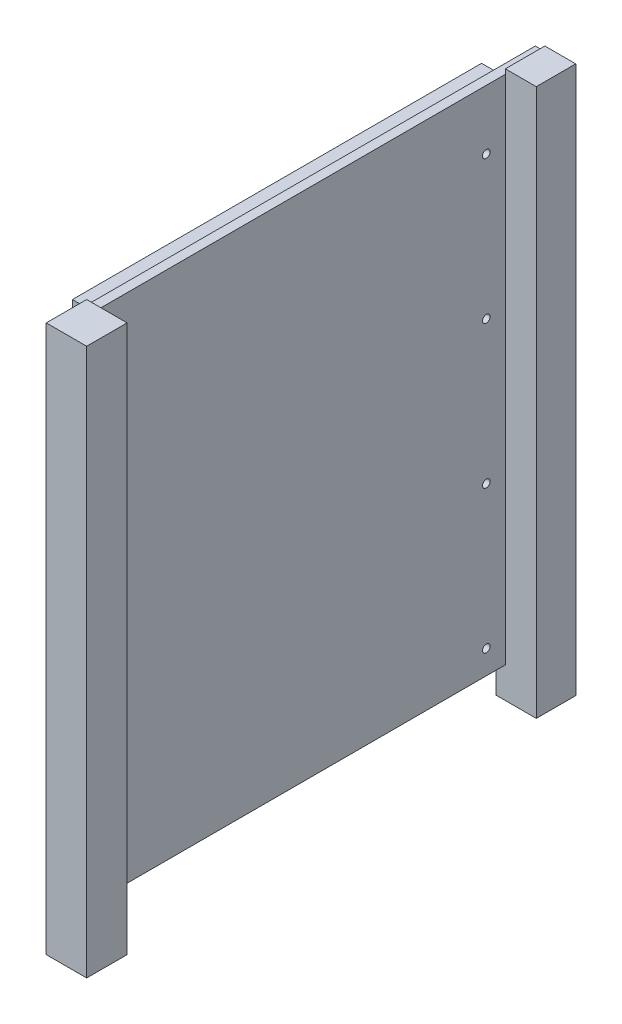
from build123d import *

# Parameters (mm, degrees)
SKETCH1_W             = 8.5
SKETCH1_H             = 115
BOSS_EXTRUDE1_DEPTH   = 8.5
BOSS_EXTRUDE2_DEPTH   = 2
SKETCH3_W             = 8.3
SKETCH3_H             = 115
BOSS_EXTRUDE3_DEPTH   = 6.5
SKETCH4_W             = 86
SKETCH4_H             = 107
BOSS_EXTRUDE4_DEPTH   = 3
SKETCH5_W             = 78
SKETCH5_H             = 99
CUT_EXTRUDE1_DEPTH    = 152.589420805
FILLET2_R             = 3
FILLET12_R            = 2
FILLET13_R            = 2
SKETCH64_W            = 78
SKETCH64_H            = 99
BOSS_EXTRUDE12_DEPTH  = 5
M2X0_4_TAPPED_HOLE1_D = 1.6


with BuildPart() as part:
    # Sketch1 → Boss-Extrude1 (new body)
    with BuildSketch(Plane(origin=(4.25, 0, 0), x_dir=(0, 0, -1), z_dir=(1, 0, 0))):
        with Locations((0, 57.5)):
            Rectangle(SKETCH1_W, SKETCH1_H)
    extrude(amount=-BOSS_EXTRUDE1_DEPTH)

    # Sketch2 → Boss-Extrude2 (add)
    with BuildSketch(Plane(origin=(-4.25, 0, 0), x_dir=(0, -1, 0), z_dir=(-1, 0, 0))):
        Polygon((-6.5, -90.25), (-6.5, -4.25), (-114, -4.25), (-114, -98.55), (0, -98.55), (0, -90.25), align=None)
    extrude(amount=-BOSS_EXTRUDE2_DEPTH)

    # Sketch3 → Boss-Extrude3 (add)
    with BuildSketch(Plane(origin=(-2.25, 0, 0), x_dir=(0, 0, -1), z_dir=(1, 0, 0))):
        with Locations((94.4, 57.5)):
            Rectangle(SKETCH3_W, SKETCH3_H)
    extrude(amount=BOSS_EXTRUDE3_DEPTH)

    # Sketch4 → Boss-Extrude4 (add)
    with BuildSketch(Plane.ZY.offset(4.25)):
        with Locations((-47.25, 60)):
            Rectangle(SKETCH4_W, SKETCH4_H)
    extrude(amount=BOSS_EXTRUDE4_DEPTH)

    # Sketch5 → Cut-Extrude1 (cut, through all)
    with BuildSketch(Plane(origin=(-2.25, 0, 0), x_dir=(0, 0, -1), z_dir=(1, 0, 0))):
        with Locations((47.25, 60)):
            Rectangle(SKETCH5_W, SKETCH5_H)
    extrude(amount=-CUT_EXTRUDE1_DEPTH, mode=Mode.SUBTRACT)

    # Fillet2
    fillet2_edges = [part.edges().sort_by_distance(p)[0] for p in [
        (-4.75, 10.5, -8.25),
        (-4.75, 109.5, -8.25),
        (-4.75, 109.5, -86.25),
        (-4.75, 10.5, -86.25),
    ]]
    fillet(fillet2_edges, radius=FILLET2_R)

    # Fillet12
    fillet12_edges = [part.edges().sort_by_distance(p)[0] for p in [
        (-5.75, 6.5, -90.25),
    ]]
    fillet(fillet12_edges, radius=FILLET12_R)

    # Fillet13
    fillet13_edges = [part.edges().sort_by_distance(p)[0] for p in [
        (-5.75, 6.5, -4.25),
    ]]
    fillet(fillet13_edges, radius=FILLET13_R)

    # Sketch64 → Boss-Extrude12 (add)
    with BuildSketch(Plane(origin=(-2.25, 0, 0), x_dir=(0, 0, -1), z_dir=(1, 0, 0))):
        with Locations((47.25, 60)):
            Rectangle(SKETCH64_W, SKETCH64_H)
    extrude(amount=-BOSS_EXTRUDE12_DEPTH)

    # M2x0.4 Tapped Hole1 (through all)
    with Locations(Plane.ZY.offset(7.25)):
        with Locations((-8.25, 11.5), (-8.25, 41.5), (-8.25, 71.5), (-8.25, 101.5), (-86.25, 11.5), (-86.25, 41.5), (-86.25, 71.5), (-86.25, 101.5)):
            Hole(M2X0_4_TAPPED_HOLE1_D / 2)


solid = part.part
